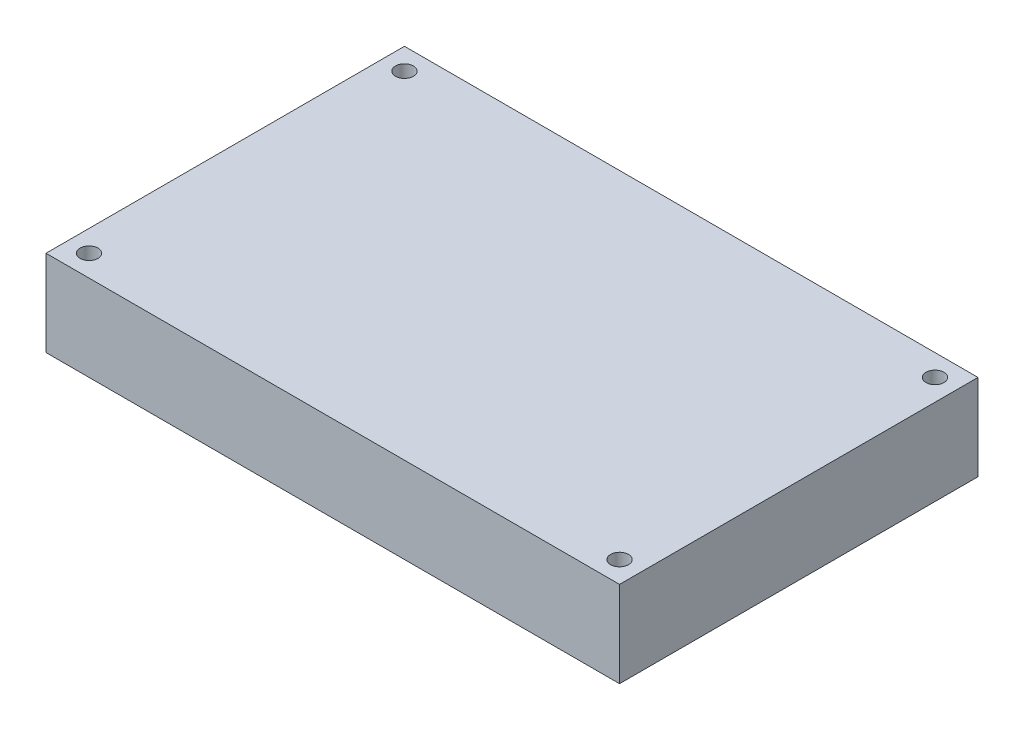
from build123d import *

# Parameters (mm, degrees)
SKETCH1_W           = 80
SKETCH1_H           = 50
SKETCH1_R           = 1.25
BOSS_EXTRUDE1_DEPTH = 12


with BuildPart() as part:
    # Sketch1 → Boss-Extrude1 (new body)
    with BuildSketch(Plane(origin=(0, 0, 0), x_dir=(1, 0, 0), z_dir=(0, 1, 0))):
        Rectangle(SKETCH1_W, SKETCH1_H)
        with Locations(Location((-37, 22, 0), (0, 0, 270))):
            Circle(SKETCH1_R, mode=Mode.SUBTRACT)
        with Locations(Location((37, 22, 0), (0, 0, 270))):
            Circle(SKETCH1_R, mode=Mode.SUBTRACT)
        with Locations(Location((37, -22, 0), (0, 0, 270))):
            Circle(SKETCH1_R, mode=Mode.SUBTRACT)
        with Locations(Location((-37, -22, 0), (0, 0, 270))):
            Circle(SKETCH1_R, mode=Mode.SUBTRACT)
    extrude(amount=BOSS_EXTRUDE1_DEPTH)


solid = part.part
